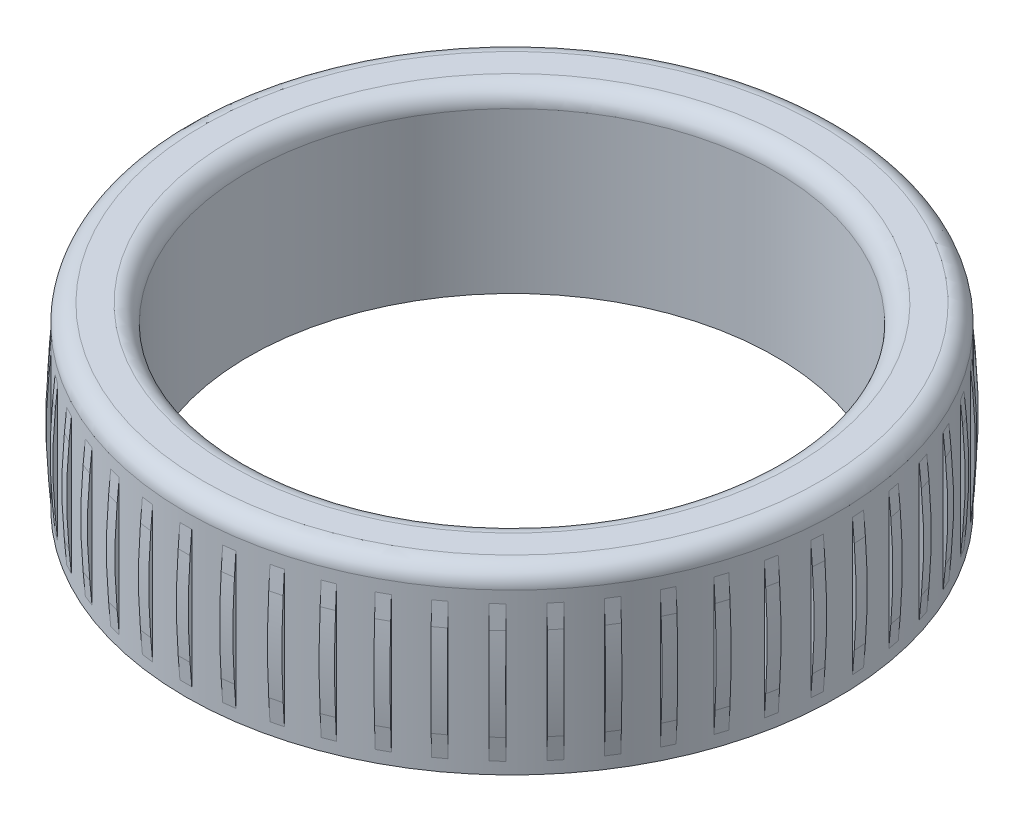
from build123d import *

# Parameters (mm, degrees)
SKETCH1_R                = 27.5
SKETCH1_R_2              = 22.225
BOSS_EXTRUDE1_DEPTH      = 15
FILLET1_R                = 1.5
BOSS_EXTRUDE2_DEPTH      = 0.5
BOSS_EXTRUDE2_DEPTH_BACK = 0.5
FILLET2_R                = 50
CIRPATTERN3_COUNT        = 50


with BuildPart() as part:
    # Sketch1 → Boss-Extrude1 (new body)
    with BuildSketch(Plane(origin=(0, 0, 0), x_dir=(1, 0, 0), z_dir=(0, 1, 0))):
        Circle(SKETCH1_R)
        Circle(SKETCH1_R_2, mode=Mode.SUBTRACT)
    extrude(amount=BOSS_EXTRUDE1_DEPTH)

    # Fillet1
    fillet1_edges = [part.edges().sort_by_distance(p)[0] for p in [
        (-27.5, 15, 0),
        (-22.225, 15, 0),
    ]]
    fillet(fillet1_edges, radius=FILLET1_R)


with BuildPart() as body_2:
    # Sketch2 → Boss-Extrude2 (new, two sides: drawn at the far end of the back side and taken through both)
    with BuildSketch(Plane(origin=(0, 0, 0), x_dir=(0, 0, -1), z_dir=(1, 0, 0)).offset(-BOSS_EXTRUDE2_DEPTH_BACK)):
        Polygon((27.5, 12.5), (27.95, 6.75), (27.5, 1), align=None)
    extrude(amount=BOSS_EXTRUDE2_DEPTH + BOSS_EXTRUDE2_DEPTH_BACK)

    # Fillet2
    fillet2_edges = [body_2.edges().sort_by_distance(p)[0] for p in [
        (0, 6.75, -27.95),
    ]]
    fillet(fillet2_edges, radius=FILLET2_R)


with BuildPart() as cirpattern3_1:
    # CirPattern3: pattern copy
    add(body_2.part.rotate(Axis((0, 13.5, 0), (0, -1, 0)), 1 * 360 / CIRPATTERN3_COUNT))


with BuildPart() as cirpattern3_2:
    # CirPattern3: pattern copy
    add(body_2.part.rotate(Axis((0, 13.5, 0), (0, -1, 0)), 2 * 360 / CIRPATTERN3_COUNT))


with BuildPart() as cirpattern3_3:
    # CirPattern3: pattern copy
    add(body_2.part.rotate(Axis((0, 13.5, 0), (0, -1, 0)), 3 * 360 / CIRPATTERN3_COUNT))


with BuildPart() as cirpattern3_4:
    # CirPattern3: pattern copy
    add(body_2.part.rotate(Axis((0, 13.5, 0), (0, -1, 0)), 4 * 360 / CIRPATTERN3_COUNT))


with BuildPart() as cirpattern3_5:
    # CirPattern3: pattern copy
    add(body_2.part.rotate(Axis((0, 13.5, 0), (0, -1, 0)), 5 * 360 / CIRPATTERN3_COUNT))


with BuildPart() as cirpattern3_6:
    # CirPattern3: pattern copy
    add(body_2.part.rotate(Axis((0, 13.5, 0), (0, -1, 0)), 6 * 360 / CIRPATTERN3_COUNT))


with BuildPart() as cirpattern3_7:
    # CirPattern3: pattern copy
    add(body_2.part.rotate(Axis((0, 13.5, 0), (0, -1, 0)), 7 * 360 / CIRPATTERN3_COUNT))


with BuildPart() as cirpattern3_8:
    # CirPattern3: pattern copy
    add(body_2.part.rotate(Axis((0, 13.5, 0), (0, -1, 0)), 8 * 360 / CIRPATTERN3_COUNT))


with BuildPart() as cirpattern3_9:
    # CirPattern3: pattern copy
    add(body_2.part.rotate(Axis((0, 13.5, 0), (0, -1, 0)), 9 * 360 / CIRPATTERN3_COUNT))


with BuildPart() as cirpattern3_10:
    # CirPattern3: pattern copy
    add(body_2.part.rotate(Axis((0, 13.5, 0), (0, -1, 0)), 10 * 360 / CIRPATTERN3_COUNT))


with BuildPart() as cirpattern3_11:
    # CirPattern3: pattern copy
    add(body_2.part.rotate(Axis((0, 13.5, 0), (0, -1, 0)), 11 * 360 / CIRPATTERN3_COUNT))


with BuildPart() as cirpattern3_12:
    # CirPattern3: pattern copy
    add(body_2.part.rotate(Axis((0, 13.5, 0), (0, -1, 0)), 12 * 360 / CIRPATTERN3_COUNT))


with BuildPart() as cirpattern3_13:
    # CirPattern3: pattern copy
    add(body_2.part.rotate(Axis((0, 13.5, 0), (0, -1, 0)), 13 * 360 / CIRPATTERN3_COUNT))


with BuildPart() as cirpattern3_14:
    # CirPattern3: pattern copy
    add(body_2.part.rotate(Axis((0, 13.5, 0), (0, -1, 0)), 14 * 360 / CIRPATTERN3_COUNT))


with BuildPart() as cirpattern3_15:
    # CirPattern3: pattern copy
    add(body_2.part.rotate(Axis((0, 13.5, 0), (0, -1, 0)), 15 * 360 / CIRPATTERN3_COUNT))


with BuildPart() as cirpattern3_16:
    # CirPattern3: pattern copy
    add(body_2.part.rotate(Axis((0, 13.5, 0), (0, -1, 0)), 16 * 360 / CIRPATTERN3_COUNT))


with BuildPart() as cirpattern3_17:
    # CirPattern3: pattern copy
    add(body_2.part.rotate(Axis((0, 13.5, 0), (0, -1, 0)), 17 * 360 / CIRPATTERN3_COUNT))


with BuildPart() as cirpattern3_18:
    # CirPattern3: pattern copy
    add(body_2.part.rotate(Axis((0, 13.5, 0), (0, -1, 0)), 18 * 360 / CIRPATTERN3_COUNT))


with BuildPart() as cirpattern3_19:
    # CirPattern3: pattern copy
    add(body_2.part.rotate(Axis((0, 13.5, 0), (0, -1, 0)), 19 * 360 / CIRPATTERN3_COUNT))


with BuildPart() as cirpattern3_20:
    # CirPattern3: pattern copy
    add(body_2.part.rotate(Axis((0, 13.5, 0), (0, -1, 0)), 20 * 360 / CIRPATTERN3_COUNT))


with BuildPart() as cirpattern3_21:
    # CirPattern3: pattern copy
    add(body_2.part.rotate(Axis((0, 13.5, 0), (0, -1, 0)), 21 * 360 / CIRPATTERN3_COUNT))


with BuildPart() as cirpattern3_22:
    # CirPattern3: pattern copy
    add(body_2.part.rotate(Axis((0, 13.5, 0), (0, -1, 0)), 22 * 360 / CIRPATTERN3_COUNT))


with BuildPart() as cirpattern3_23:
    # CirPattern3: pattern copy
    add(body_2.part.rotate(Axis((0, 13.5, 0), (0, -1, 0)), 23 * 360 / CIRPATTERN3_COUNT))


with BuildPart() as cirpattern3_24:
    # CirPattern3: pattern copy
    add(body_2.part.rotate(Axis((0, 13.5, 0), (0, -1, 0)), 24 * 360 / CIRPATTERN3_COUNT))


with BuildPart() as cirpattern3_25:
    # CirPattern3: pattern copy
    add(body_2.part.rotate(Axis((0, 13.5, 0), (0, -1, 0)), 25 * 360 / CIRPATTERN3_COUNT))


with BuildPart() as cirpattern3_26:
    # CirPattern3: pattern copy
    add(body_2.part.rotate(Axis((0, 13.5, 0), (0, -1, 0)), 26 * 360 / CIRPATTERN3_COUNT))


with BuildPart() as cirpattern3_27:
    # CirPattern3: pattern copy
    add(body_2.part.rotate(Axis((0, 13.5, 0), (0, -1, 0)), 27 * 360 / CIRPATTERN3_COUNT))


with BuildPart() as cirpattern3_28:
    # CirPattern3: pattern copy
    add(body_2.part.rotate(Axis((0, 13.5, 0), (0, -1, 0)), 28 * 360 / CIRPATTERN3_COUNT))


with BuildPart() as cirpattern3_29:
    # CirPattern3: pattern copy
    add(body_2.part.rotate(Axis((0, 13.5, 0), (0, -1, 0)), 29 * 360 / CIRPATTERN3_COUNT))


with BuildPart() as cirpattern3_30:
    # CirPattern3: pattern copy
    add(body_2.part.rotate(Axis((0, 13.5, 0), (0, -1, 0)), 30 * 360 / CIRPATTERN3_COUNT))


with BuildPart() as cirpattern3_31:
    # CirPattern3: pattern copy
    add(body_2.part.rotate(Axis((0, 13.5, 0), (0, -1, 0)), 31 * 360 / CIRPATTERN3_COUNT))


with BuildPart() as cirpattern3_32:
    # CirPattern3: pattern copy
    add(body_2.part.rotate(Axis((0, 13.5, 0), (0, -1, 0)), 32 * 360 / CIRPATTERN3_COUNT))


with BuildPart() as cirpattern3_33:
    # CirPattern3: pattern copy
    add(body_2.part.rotate(Axis((0, 13.5, 0), (0, -1, 0)), 33 * 360 / CIRPATTERN3_COUNT))


with BuildPart() as cirpattern3_34:
    # CirPattern3: pattern copy
    add(body_2.part.rotate(Axis((0, 13.5, 0), (0, -1, 0)), 34 * 360 / CIRPATTERN3_COUNT))


with BuildPart() as cirpattern3_35:
    # CirPattern3: pattern copy
    add(body_2.part.rotate(Axis((0, 13.5, 0), (0, -1, 0)), 35 * 360 / CIRPATTERN3_COUNT))


with BuildPart() as cirpattern3_36:
    # CirPattern3: pattern copy
    add(body_2.part.rotate(Axis((0, 13.5, 0), (0, -1, 0)), 36 * 360 / CIRPATTERN3_COUNT))


with BuildPart() as cirpattern3_37:
    # CirPattern3: pattern copy
    add(body_2.part.rotate(Axis((0, 13.5, 0), (0, -1, 0)), 37 * 360 / CIRPATTERN3_COUNT))


with BuildPart() as cirpattern3_38:
    # CirPattern3: pattern copy
    add(body_2.part.rotate(Axis((0, 13.5, 0), (0, -1, 0)), 38 * 360 / CIRPATTERN3_COUNT))


with BuildPart() as cirpattern3_39:
    # CirPattern3: pattern copy
    add(body_2.part.rotate(Axis((0, 13.5, 0), (0, -1, 0)), 39 * 360 / CIRPATTERN3_COUNT))


with BuildPart() as cirpattern3_40:
    # CirPattern3: pattern copy
    add(body_2.part.rotate(Axis((0, 13.5, 0), (0, -1, 0)), 40 * 360 / CIRPATTERN3_COUNT))


with BuildPart() as cirpattern3_41:
    # CirPattern3: pattern copy
    add(body_2.part.rotate(Axis((0, 13.5, 0), (0, -1, 0)), 41 * 360 / CIRPATTERN3_COUNT))


with BuildPart() as cirpattern3_42:
    # CirPattern3: pattern copy
    add(body_2.part.rotate(Axis((0, 13.5, 0), (0, -1, 0)), 42 * 360 / CIRPATTERN3_COUNT))


with BuildPart() as cirpattern3_43:
    # CirPattern3: pattern copy
    add(body_2.part.rotate(Axis((0, 13.5, 0), (0, -1, 0)), 43 * 360 / CIRPATTERN3_COUNT))


with BuildPart() as cirpattern3_44:
    # CirPattern3: pattern copy
    add(body_2.part.rotate(Axis((0, 13.5, 0), (0, -1, 0)), 44 * 360 / CIRPATTERN3_COUNT))


with BuildPart() as cirpattern3_45:
    # CirPattern3: pattern copy
    add(body_2.part.rotate(Axis((0, 13.5, 0), (0, -1, 0)), 45 * 360 / CIRPATTERN3_COUNT))


with BuildPart() as cirpattern3_46:
    # CirPattern3: pattern copy
    add(body_2.part.rotate(Axis((0, 13.5, 0), (0, -1, 0)), 46 * 360 / CIRPATTERN3_COUNT))


with BuildPart() as cirpattern3_47:
    # CirPattern3: pattern copy
    add(body_2.part.rotate(Axis((0, 13.5, 0), (0, -1, 0)), 47 * 360 / CIRPATTERN3_COUNT))


with BuildPart() as cirpattern3_48:
    # CirPattern3: pattern copy
    add(body_2.part.rotate(Axis((0, 13.5, 0), (0, -1, 0)), 48 * 360 / CIRPATTERN3_COUNT))


with BuildPart() as cirpattern3_49:
    # CirPattern3: pattern copy
    add(body_2.part.rotate(Axis((0, 13.5, 0), (0, -1, 0)), 49 * 360 / CIRPATTERN3_COUNT))


solid = Compound([part.part, body_2.part, cirpattern3_1.part, cirpattern3_2.part, cirpattern3_3.part, cirpattern3_4.part, cirpattern3_5.part, cirpattern3_6.part, cirpattern3_7.part, cirpattern3_8.part, cirpattern3_9.part, cirpattern3_10.part, cirpattern3_11.part, cirpattern3_12.part, cirpattern3_13.part, cirpattern3_14.part, cirpattern3_15.part, cirpattern3_16.part, cirpattern3_17.part, cirpattern3_18.part, cirpattern3_19.part, cirpattern3_20.part, cirpattern3_21.part, cirpattern3_22.part, cirpattern3_23.part, cirpattern3_24.part, cirpattern3_25.part, cirpattern3_26.part, cirpattern3_27.part, cirpattern3_28.part, cirpattern3_29.part, cirpattern3_30.part, cirpattern3_31.part, cirpattern3_32.part, cirpattern3_33.part, cirpattern3_34.part, cirpattern3_35.part, cirpattern3_36.part, cirpattern3_37.part, cirpattern3_38.part, cirpattern3_39.part, cirpattern3_40.part, cirpattern3_41.part, cirpattern3_42.part, cirpattern3_43.part, cirpattern3_44.part, cirpattern3_45.part, cirpattern3_46.part, cirpattern3_47.part, cirpattern3_48.part, cirpattern3_49.part])
